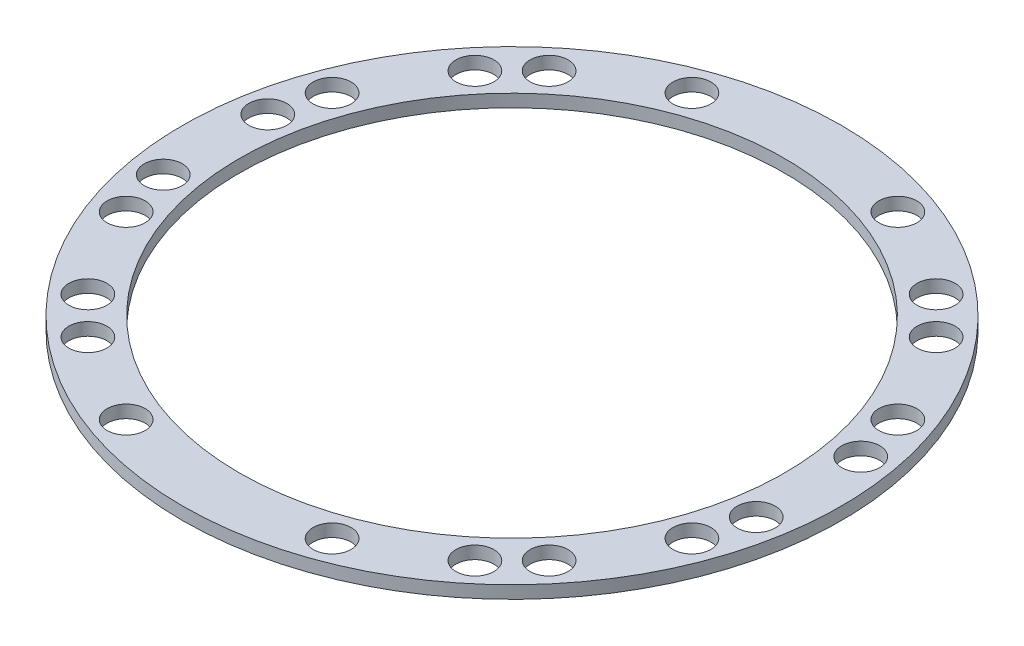
from build123d import *

# Parameters (mm, degrees)
SKETCH1_R               = 2600
SKETCH1_R_2             = 2150
BOSS_EXTRUDE1_DEPTH     = 100
SKETCH2_R               = 150
CUT_EXTRUDE1_DEPTH      = 3679.31483155
CIRPATTERN1_COUNT       = 5
CIRPATTERN1_ANGLE       = 120
MIRROR1_COPY_1_SKETCH_R = 150
MIRROR1_COPY_1_DEPTH    = 3679.31483155
MIRROR1_COPY_2_SKETCH_R = 150
MIRROR1_COPY_2_DEPTH    = 3679.31483155
MIRROR1_COPY_3_SKETCH_R = 150
MIRROR1_COPY_3_DEPTH    = 3679.31483155
MIRROR1_COPY_4_SKETCH_R = 150
MIRROR1_COPY_4_DEPTH    = 3679.31483155


with BuildPart() as part:
    # Sketch1 → Boss-Extrude1 (new body)
    with BuildSketch(Plane(origin=(0, 0, 0), x_dir=(1, 0, 0), z_dir=(0, 1, 0))):
        with Locations(Location((0, 0, 0), (0, 0, 270))):
            Circle(SKETCH1_R)
        with Locations(Location((0, 0, 0), (0, 0, 270))):
            Circle(SKETCH1_R_2, mode=Mode.SUBTRACT)
    extrude(amount=BOSS_EXTRUDE1_DEPTH)

    # Sketch2 → Cut-Extrude1 (cut, through all)
    with BuildSketch(Plane(origin=(0, 100, 0), x_dir=(1, 0, 0), z_dir=(0, 1, 0))):
        with Locations(Location((812.297840398, -2231.769974367, 0), (0, 0, 270))):
            Circle(SKETCH2_R)
        with Locations(Location((1526.620573006, -1819.355552408, 0), (0, 0, 270))):
            Circle(SKETCH2_R)
    cut_extrude1 = extrude(amount=-CUT_EXTRUDE1_DEPTH, mode=Mode.SUBTRACT)

    # CirPattern1: Cut-Extrude1 ×5 about axis
    cirpattern1_axis = Axis((0, 0, 0), (0, 1, 0))
    for i in range(1, CIRPATTERN1_COUNT):
        add(cut_extrude1.rotate(cirpattern1_axis, i * CIRPATTERN1_ANGLE / (CIRPATTERN1_COUNT - 1)), mode=Mode.SUBTRACT)

    # Mirror1: Cut-Extrude1 across plane
    add(cut_extrude1.mirror(Plane(origin=(0, 0, 0), x_dir=(0, 0, 1), z_dir=(1, 0, 0))), mode=Mode.SUBTRACT)

    # Mirror1 copy 1 sketch → Mirror1 copy 1 (cut, through all)
    with BuildSketch(Plane(origin=(0, 100, 0), x_dir=(-0.866025403784438, 0, -0.5000000000000011), z_dir=(0, 1, 0))):
        with Locations((812.297840398, 2231.769974367)):
            Circle(MIRROR1_COPY_1_SKETCH_R)
        with Locations((1526.620573006, 1819.355552408)):
            Circle(MIRROR1_COPY_1_SKETCH_R)
    extrude(amount=-MIRROR1_COPY_1_DEPTH, mode=Mode.SUBTRACT)

    # Mirror1 copy 2 sketch → Mirror1 copy 2 (cut, through all)
    with BuildSketch(Plane(origin=(0, 100, 0), x_dir=(-0.4999999999999978, 0, -0.8660254037844399), z_dir=(0, 1, 0))):
        with Locations((812.297840398, 2231.769974367)):
            Circle(MIRROR1_COPY_2_SKETCH_R)
        with Locations((1526.620573006, 1819.355552408)):
            Circle(MIRROR1_COPY_2_SKETCH_R)
    extrude(amount=-MIRROR1_COPY_2_DEPTH, mode=Mode.SUBTRACT)

    # Mirror1 copy 3 sketch → Mirror1 copy 3 (cut, through all)
    with BuildSketch(Plane(origin=(0, 100, 0), x_dir=(0, 0, -1), z_dir=(0, 1, 0))):
        with Locations((812.297840398, 2231.769974367)):
            Circle(MIRROR1_COPY_3_SKETCH_R)
        with Locations((1526.620573006, 1819.355552408)):
            Circle(MIRROR1_COPY_3_SKETCH_R)
    extrude(amount=-MIRROR1_COPY_3_DEPTH, mode=Mode.SUBTRACT)

    # Mirror1 copy 4 sketch → Mirror1 copy 4 (cut, through all)
    with BuildSketch(Plane(origin=(0, 100, 0), x_dir=(0.5000000000000044, 0, -0.866025403784436), z_dir=(0, 1, 0))):
        with Locations((812.297840398, 2231.769974367)):
            Circle(MIRROR1_COPY_4_SKETCH_R)
        with Locations((1526.620573006, 1819.355552408)):
            Circle(MIRROR1_COPY_4_SKETCH_R)
    extrude(amount=-MIRROR1_COPY_4_DEPTH, mode=Mode.SUBTRACT)


solid = part.part
